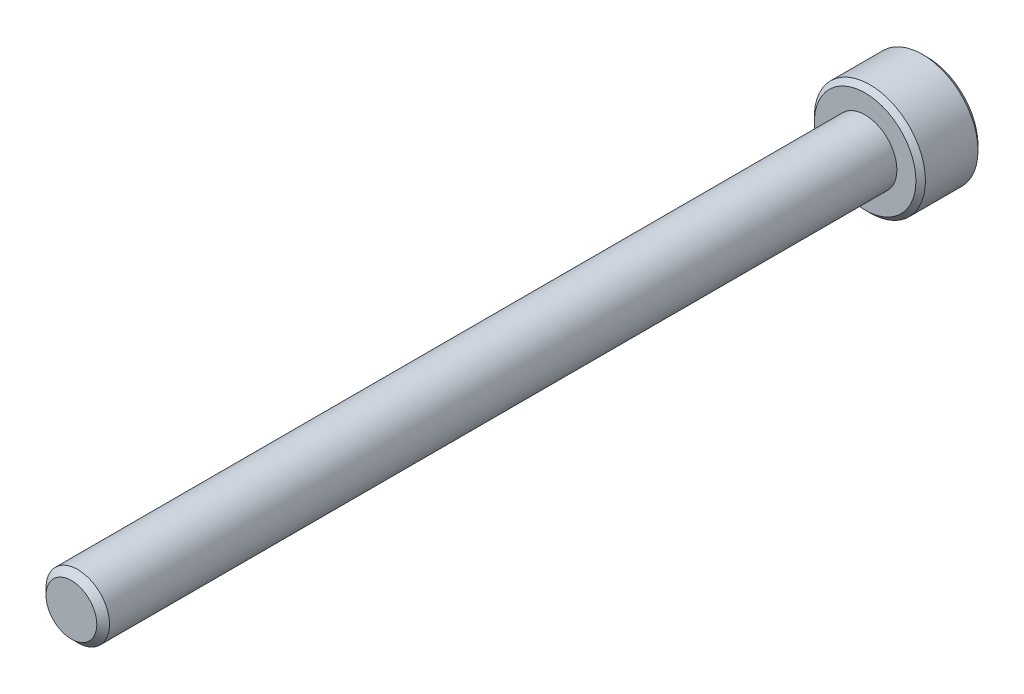
from build123d import *

# Parameters (mm, degrees)
SKETCH_1_R          = 3.5
EXTRUDE_1_DEPTH     = 3.91
SKETCH_2_R          = 2
EXTRUDE_2_DEPTH     = 50
CUT_EXTRUDE_1_DEPTH = 2
CHAMFER_1_SIZE      = 0.4
CHAMFER_2_SIZE      = 0.3


with BuildPart() as part:
    # 草图1 → 凸台-拉伸1 (new body)
    with BuildSketch(Plane.XY):
        Circle(SKETCH_1_R)
    extrude(amount=EXTRUDE_1_DEPTH)

    # 草图2 → 凸台-拉伸2 (add)
    with BuildSketch(Plane.XY.offset(3.91)):
        Circle(SKETCH_2_R)
    extrude(amount=EXTRUDE_2_DEPTH)

    # 草图3 → 切除-拉伸1 (cut)
    with BuildSketch(Plane(origin=(0, 0, 0), x_dir=(-1, 0, 0), z_dir=(0, 0, -1))):
        Polygon((0, 1.760918321), (-1.525, 0.880459161), (-1.525, -0.880459161), (0, -1.760918321), (1.525, -0.880459161), (1.525, 0.880459161), align=None)
    extrude(amount=-CUT_EXTRUDE_1_DEPTH, mode=Mode.SUBTRACT)

    # 倒角1
    chamfer_1_edges = [part.edges().sort_by_distance(p)[0] for p in [
        (-2, 0, 53.91),
    ]]
    chamfer(chamfer_1_edges, length=CHAMFER_1_SIZE)

    # 倒角2
    chamfer_2_edges = [part.edges().sort_by_distance(p)[0] for p in [
        (-3.5, 0, 0),
        (-3.5, 0, 3.91),
    ]]
    chamfer(chamfer_2_edges, length=CHAMFER_2_SIZE)


solid = part.part
